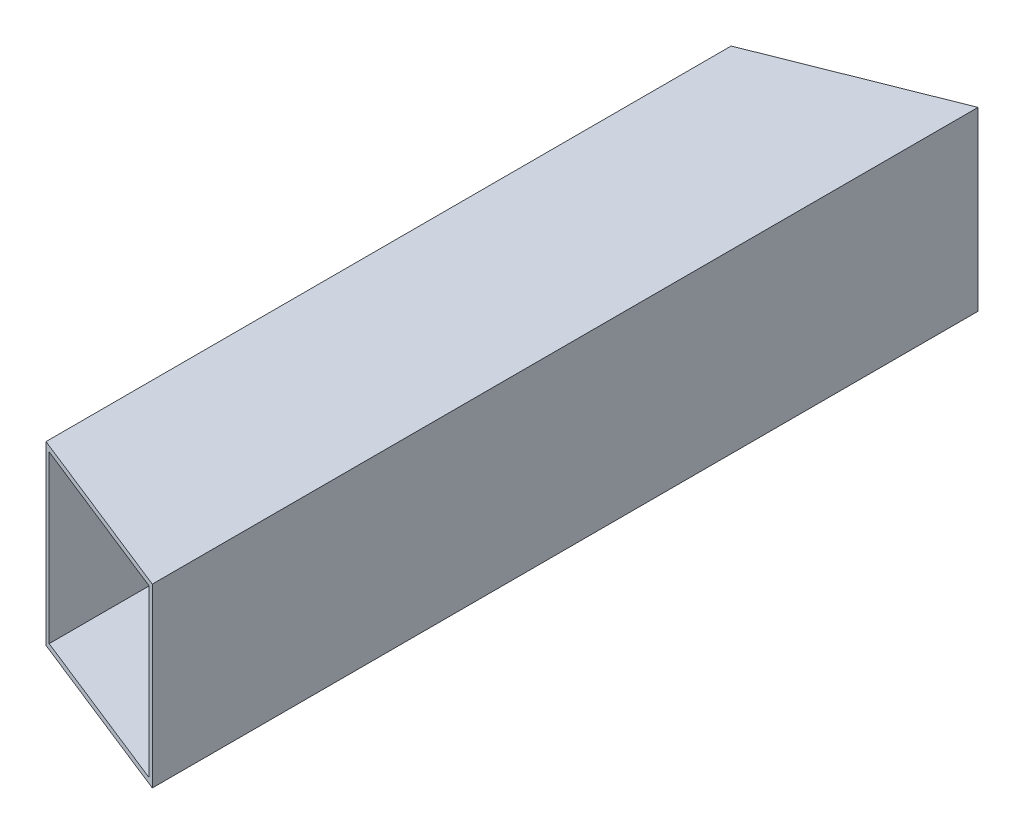
from build123d import *

# Parameters (mm, degrees)
ESBO_O1_W                = 31.890446896
ESBO_O1_H                = 31.890446896
ESBO_O1_W_2              = 30
ESBO_O1_H_2              = 30
RESSALTO_EXTRUS_O1_DEPTH = 149.11688245
CORTE_EXTRUS_O1_DEPTH    = 154.320238017


with BuildPart() as part:
    # Esboço1 → Ressalto-extrusão1 (new body)
    with BuildSketch(Plane.XY):
        Rectangle(ESBO_O1_W, ESBO_O1_H)
        Rectangle(ESBO_O1_W_2, ESBO_O1_H_2, mode=Mode.SUBTRACT)
    extrude(amount=RESSALTO_EXTRUS_O1_DEPTH)

    # Esboço3 → Corte-extrusão1 (cut, symmetric)
    with BuildSketch(Plane(origin=(0, 15.945223448, 0), x_dir=(1, 0, 0), z_dir=(0, 1, 0))):
        Polygon((-15.945223448, -12.692594834), (15.945223448, 0), (-15.945223448, 0), align=None)
    corte_extrus_o1 = extrude(amount=CORTE_EXTRUS_O1_DEPTH, both=True, mode=Mode.SUBTRACT)

    # Espelhar5: Corte-extrusão1 across plane
    add(corte_extrus_o1.mirror(Plane(origin=(0, 0, 74.558441225), x_dir=(1, 0, 0), z_dir=(0, 0, -1))), mode=Mode.SUBTRACT)


solid = part.part
